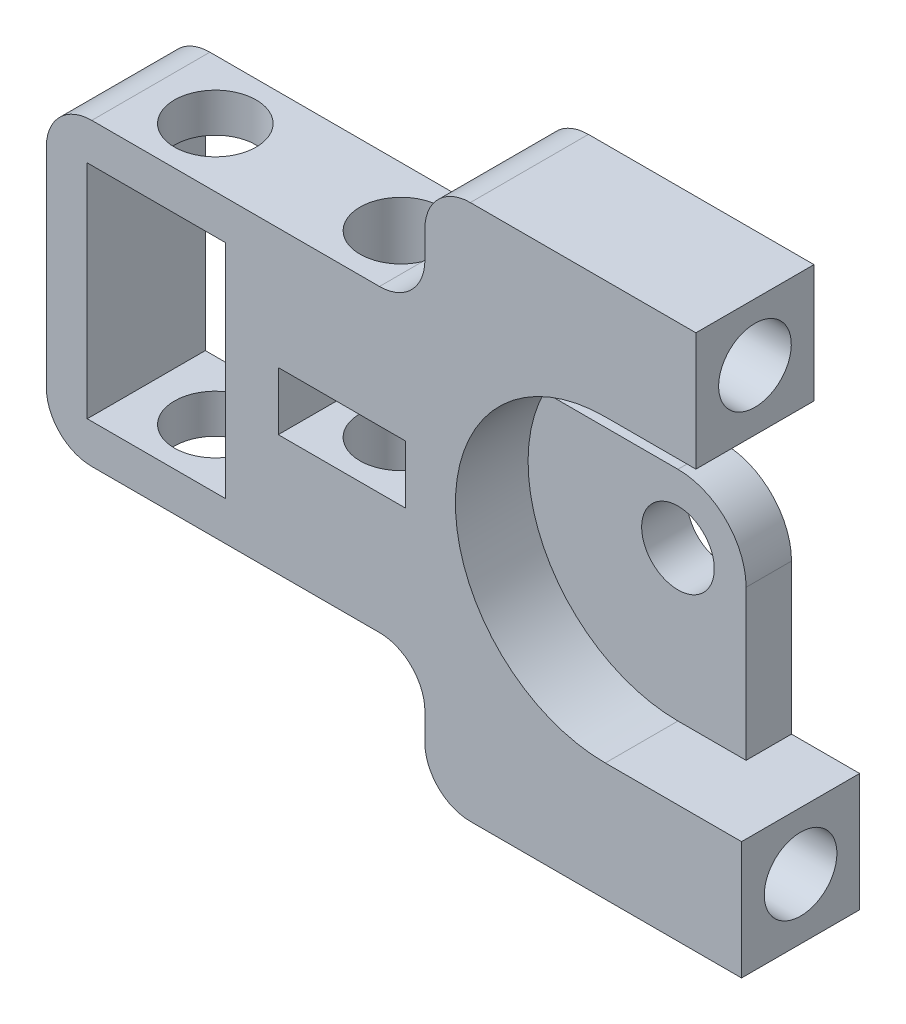
from build123d import *

# Parameters (mm, degrees)
CROQUIS1_W              = 15.2
CROQUIS1_H              = 24.4
CROQUIS1_W_2            = 14
CROQUIS1_H_2            = 6.4
SALIENTE_EXTRUIR2_DEPTH = 8
SALIENTE_EXTRUIR4_START = 5
CROQUIS2_W              = 14
CROQUIS2_H              = 6.4
CROQUIS2_W_2            = 15.2
CROQUIS2_H_2            = 24.4
CROQUIS2_R              = 4
SALIENTE_EXTRUIR4_DEPTH = 5
CROQUIS3_R              = 4
CORTAR_EXTRUIR1_DEPTH   = 25
CROQUIS4_R              = 4
CORTAR_EXTRUIR2_DEPTH   = 30.02
CORTAR_EXTRUIR3_REACH   = 79.24
CROQUIS5_R              = 4.5


with BuildPart() as part:
    # Croquis1 → Saliente-Extruir2 (new body)
    with BuildSketch(Plane.XY):
        with BuildLine():
            Line((9.976185601, 29.499985584), (9.976185601, 16.499985584))
            Line((9.976185601, 16.499985584), (0.021811005, 16.499985584))
            ThreePointArc((0.021811005, 16.499985584), (-16.499996396, 0.010905505), (0, -16.5))
            Line((0, -16.5), (15, -16.5))
            Line((15, -16.5), (15, -29.5))
            Line((15, -29.5), (-14.857693224, -29.5))
            ThreePointArc((-14.857693224, -29.5), (-18.39322713, -28.035533906), (-19.857693224, -24.5))
            Line((-19.857693224, -24.5), (-19.857693224, -21.5))
            ThreePointArc((-19.857693224, -21.5), (-21.322159318, -17.964466094), (-24.857693224, -16.5))
            Line((-24.857693224, -16.5), (-56.53, -16.5))
            ThreePointArc((-56.53, -16.5), (-60.065533906, -15.035533906), (-61.53, -11.5))
            Line((-61.53, -11.5), (-61.53, 11.5))
            ThreePointArc((-61.53, 11.5), (-60.065533906, 15.035533906), (-56.53, 16.5))
            Line((-56.53, 16.5), (-24.857693224, 16.5))
            ThreePointArc((-24.857693224, 16.5), (-21.322159318, 17.964466094), (-19.857693224, 21.5))
            Line((-19.857693224, 21.5), (-19.857693224, 24.499985584))
            ThreePointArc((-19.857693224, 24.499985584), (-18.39322713, 28.03551949), (-14.857693224, 29.499985584))
            Line((-14.857693224, 29.499985584), (9.976185601, 29.499985584))
        make_face()
        with Locations((-49.43, 0)):
            Rectangle(CROQUIS1_W, CROQUIS1_H, mode=Mode.SUBTRACT)
        with Locations((-29, 0)):
            Rectangle(CROQUIS1_W_2, CROQUIS1_H_2, mode=Mode.SUBTRACT)
    extrude(amount=SALIENTE_EXTRUIR2_DEPTH)

    # Croquis2 → Saliente-Extruir4 (add)
    with BuildSketch(Plane(origin=(0, 0, 0), x_dir=(-1, 0, 0), z_dir=(0, 0, -1)).offset(SALIENTE_EXTRUIR4_START)):
        with BuildLine():
            Line((56.53, 16.5), (24.857693224, 16.5))
            ThreePointArc((24.857693224, 16.5), (21.322159318, 17.964466094), (19.857693224, 21.5))
            Line((19.857693224, 21.5), (19.857693224, 24.499985584))
            ThreePointArc((19.857693224, 24.499985584), (18.39322713, 28.03551949), (14.857693224, 29.499985584))
            Line((14.857693224, 29.499985584), (-9.976185601, 29.499985584))
            Line((-9.976185601, 29.499985584), (-9.976185601, 16.499985584))
            Line((-9.976185601, 16.499985584), (-0.021811005, 16.499985584))
            ThreePointArc((-0.021811005, 16.499985584), (8.607541842, 14.07693942), (14.696938457, 7.5))
            Line((14.696938457, 7.5), (0, 7.5))
            ThreePointArc((0, 7.5), (-5.303300859, 5.303300859), (-7.5, 0))
            Line((-7.5, 0), (-7.5, -16.5))
            Line((-7.5, -16.5), (-15, -16.5))
            Line((-15, -16.5), (-15, -29.5))
            Line((-15, -29.5), (14.857693224, -29.5))
            ThreePointArc((14.857693224, -29.5), (18.39322713, -28.035533906), (19.857693224, -24.5))
            Line((19.857693224, -24.5), (19.857693224, -21.5))
            ThreePointArc((19.857693224, -21.5), (21.322159318, -17.964466094), (24.857693224, -16.5))
            Line((24.857693224, -16.5), (56.53, -16.5))
            ThreePointArc((56.53, -16.5), (60.065533906, -15.035533906), (61.53, -11.5))
            Line((61.53, -11.5), (61.53, 11.5))
            ThreePointArc((61.53, 11.5), (60.065533906, 15.035533906), (56.53, 16.5))
        make_face()
        with Locations((29, 0)):
            Rectangle(CROQUIS2_W, CROQUIS2_H, mode=Mode.SUBTRACT)
        with Locations((49.43, 0)):
            Rectangle(CROQUIS2_W_2, CROQUIS2_H_2, mode=Mode.SUBTRACT)
        Circle(CROQUIS2_R, mode=Mode.SUBTRACT)
    extrude(amount=-SALIENTE_EXTRUIR4_DEPTH)

    # Croquis3 → Cortar-Extruir1 (cut)
    with BuildSketch(Plane(origin=(9.976185601, 0, 0), x_dir=(0, 0, -1), z_dir=(1, 0, 0))):
        with Locations(Location((-1.5, 23.151636707, 0), (0, 0, 90))):
            Circle(CROQUIS3_R)
    extrude(amount=-CORTAR_EXTRUIR1_DEPTH, mode=Mode.SUBTRACT)

    # Croquis4 → Cortar-Extruir2 (cut)
    with BuildSketch(Plane(origin=(15, 0, 0), x_dir=(0, 0, -1), z_dir=(1, 0, 0))):
        with Locations((-1.5, -22.848348878)):
            Circle(CROQUIS4_R)
    extrude(amount=-CORTAR_EXTRUIR2_DEPTH, mode=Mode.SUBTRACT)

    # Cortar-Extruir3: up to this face of the body (flat: up to its plane)
    cortar_extruir3_end = Plane(part.part.faces().sort_by_distance((-40.693846612, -16.5, 1.5))[0])
    # Croquis5 → Cortar-Extruir3 (cut, up to the picked face)
    with BuildSketch(Plane(origin=(0, 16.5, 0), x_dir=(1, 0, 0), z_dir=(0, 1, 0)), mode=Mode.PRIVATE) as cortar_extruir3_sk1:
        with Locations(Location((-49.43, -1.5, 0), (0, 0, 180))):
            Circle(CROQUIS5_R)
    cortar_extruir3_tool1 = split(extrude(cortar_extruir3_sk1.sketch, amount=-CORTAR_EXTRUIR3_REACH, mode=Mode.PRIVATE), bisect_by=cortar_extruir3_end, keep=Keep.BOTH, mode=Mode.PRIVATE)
    # Croquis5 → Cortar-Extruir3 (cut, up to the picked face)
    with BuildSketch(Plane(origin=(0, 16.5, 0), x_dir=(1, 0, 0), z_dir=(0, 1, 0)), mode=Mode.PRIVATE) as cortar_extruir3_sk2:
        with Locations(Location((-29, -1.5, 0), (0, 0, 270))):
            Circle(CROQUIS5_R)
    cortar_extruir3_tool2 = split(extrude(cortar_extruir3_sk2.sketch, amount=-CORTAR_EXTRUIR3_REACH, mode=Mode.PRIVATE), bisect_by=cortar_extruir3_end, keep=Keep.BOTH, mode=Mode.PRIVATE)
    add(cortar_extruir3_tool1.solids().sort_by(Axis((-49.43, 16.5, 1.5), (0, -1, 0)))[0], mode=Mode.SUBTRACT)
    add(cortar_extruir3_tool2.solids().sort_by(Axis((-29, 16.5, 1.5), (0, -1, 0)))[0], mode=Mode.SUBTRACT)


solid = part.part
